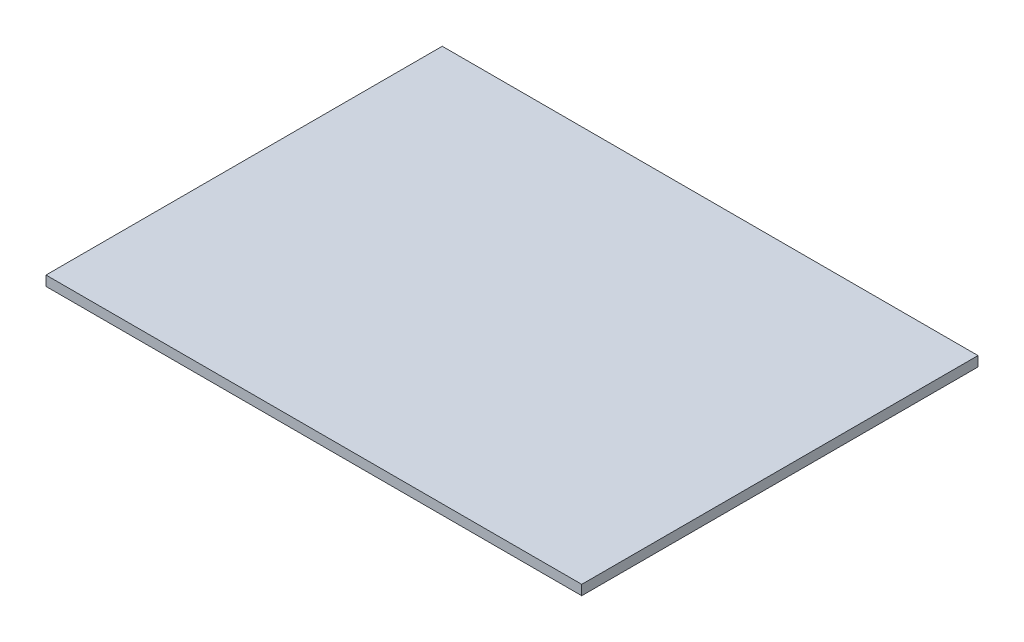
from build123d import *

# Parameters (mm, degrees)
CROQUIS1_W              = 811.2
CROQUIS1_H              = 600
SALIENTE_EXTRUIR1_DEPTH = 15


with BuildPart() as part:
    # Croquis1 → Saliente-Extruir1 (new body)
    with BuildSketch(Plane(origin=(0, 0, 0), x_dir=(1, 0, 0), z_dir=(0, 1, 0))):
        Rectangle(CROQUIS1_W, CROQUIS1_H)
    extrude(amount=SALIENTE_EXTRUIR1_DEPTH)


solid = part.part
